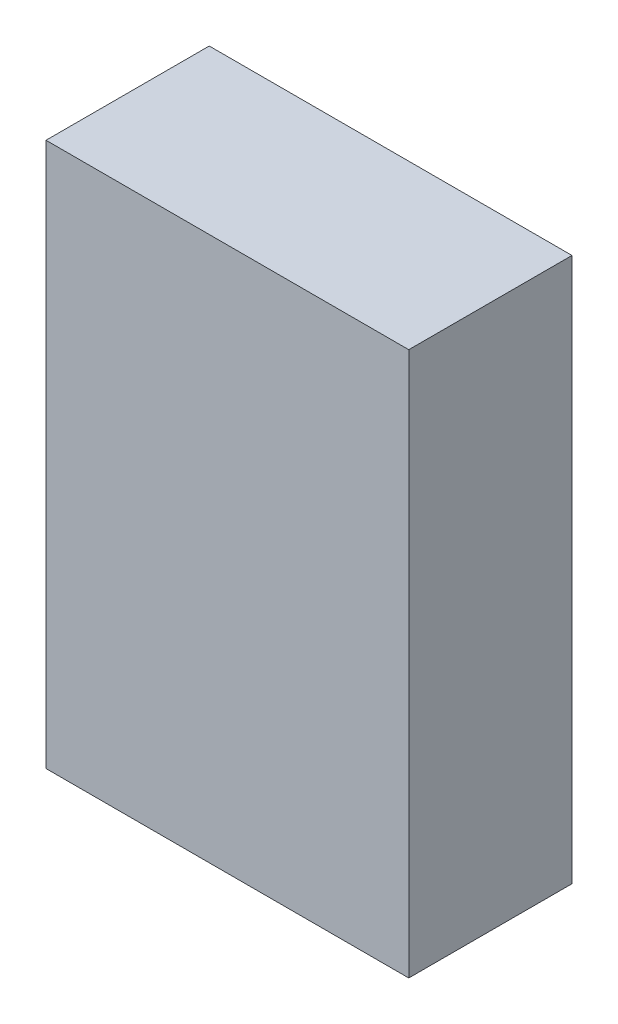
from build123d import *

# Parameters (mm, degrees)
SKETCH1_W           = 127
SKETCH1_H           = 190.5
BOSS_EXTRUDE1_DEPTH = 57.15


with BuildPart() as part:
    # Sketch1 → Boss-Extrude1 (new body)
    with BuildSketch(Plane.XY):
        Rectangle(SKETCH1_W, SKETCH1_H)
    extrude(amount=BOSS_EXTRUDE1_DEPTH)


solid = part.part
